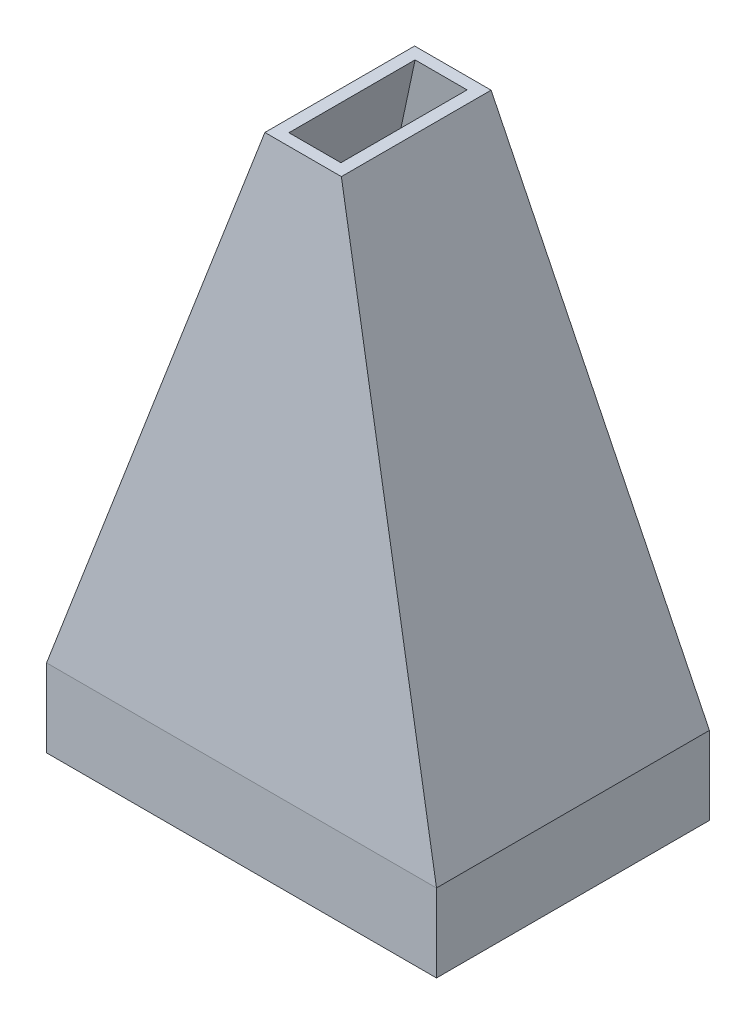
from build123d import *

# Parameters (mm, degrees)
SKETCH2_W               = 100
SKETCH2_H               = 70
BOSS_EXTRUDE1_DEPTH     = 150
CUT_EXTRUDE1_DEPTH      = 184.643676722
CUT_EXTRUDE2_DEPTH      = 162.941347407
CUT_EXTRUDE2_DEPTH_BACK = 162.941347407
SHELL1_T                = -3


with BuildPart() as part:
    # Sketch2 → Boss-Extrude1 (new body)
    with BuildSketch(Plane(origin=(0, 0, 0), x_dir=(1, 0, 0), z_dir=(0, 1, 0))):
        Rectangle(SKETCH2_W, SKETCH2_H)
    extrude(amount=BOSS_EXTRUDE1_DEPTH)

    # Sketch3 → Cut-Extrude1 (cut, through all)
    with BuildSketch(Plane.ZY.offset(50)):
        Polygon((-35, 20), (-19.2, 150), (-35, 150), align=None)
        Polygon((19.2, 150), (35, 20), (35, 150), align=None)
    extrude(amount=-CUT_EXTRUDE1_DEPTH, mode=Mode.SUBTRACT)

    # Sketch4 → Cut-Extrude2 (cut, two sides: drawn at the far end of the back side and taken through both)
    with BuildSketch(Plane.XY.offset(-CUT_EXTRUDE2_DEPTH_BACK)):
        Polygon((-50, 20), (-9.808333333, 150), (-50, 150), align=None)
        Polygon((50, 20), (9.808333333, 150), (50, 150), align=None)
    extrude(amount=CUT_EXTRUDE2_DEPTH + CUT_EXTRUDE2_DEPTH_BACK, mode=Mode.SUBTRACT)

    # Shell1
    shell1_openings = [part.faces().sort_by_distance(p)[0] for p in [
        (0, 150, 0),
        (0, 0, 0),
    ]]
    offset(amount=SHELL1_T, openings=shell1_openings, kind=Kind.INTERSECTION)


solid = part.part
